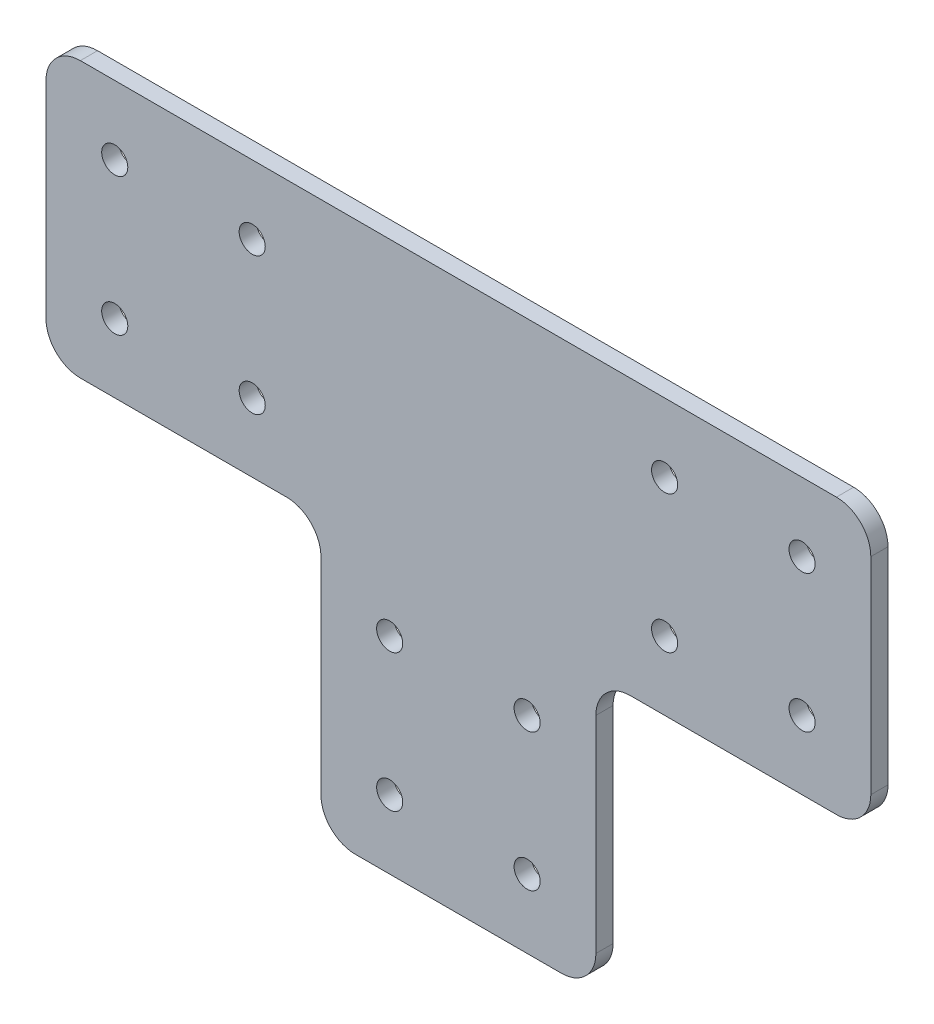
from build123d import *

# Parameters (mm, degrees)
SKETCH1_R           = 2.413
BOSS_EXTRUDE1_DEPTH = 3.175
FILLET1_R           = 6.35


with BuildPart() as part:
    # Sketch1 → Boss-Extrude1 (new body)
    with BuildSketch(Plane.XY):
        Polygon((-76.2, 0), (76.2, 0), (76.2, -50.8), (25.4, -50.8), (25.4, -101.6), (-25.4, -101.6), (-25.4, -50.8), (-76.2, -50.8), align=None)
        with Locations((-63.5, -12.7)):
            Circle(SKETCH1_R, mode=Mode.SUBTRACT)
        with Locations((-63.5, -38.1)):
            Circle(SKETCH1_R, mode=Mode.SUBTRACT)
        with Locations((-38.1, -12.7)):
            Circle(SKETCH1_R, mode=Mode.SUBTRACT)
        with Locations((-38.1, -38.1)):
            Circle(SKETCH1_R, mode=Mode.SUBTRACT)
        with Locations((-12.7, -88.9)):
            Circle(SKETCH1_R, mode=Mode.SUBTRACT)
        with Locations((-12.7, -63.5)):
            Circle(SKETCH1_R, mode=Mode.SUBTRACT)
        with Locations(Location((12.7, -88.9, 0), (0, 0, 180))):
            Circle(SKETCH1_R, mode=Mode.SUBTRACT)
        with Locations(Location((12.7, -63.5, 0), (0, 0, 180))):
            Circle(SKETCH1_R, mode=Mode.SUBTRACT)
        with Locations(Location((63.5, -38.1, 0), (0, 0, 180))):
            Circle(SKETCH1_R, mode=Mode.SUBTRACT)
        with Locations(Location((38.1, -38.1, 0), (0, 0, 180))):
            Circle(SKETCH1_R, mode=Mode.SUBTRACT)
        with Locations(Location((38.1, -12.7, 0), (0, 0, 180))):
            Circle(SKETCH1_R, mode=Mode.SUBTRACT)
        with Locations(Location((63.5, -12.7, 0), (0, 0, 180))):
            Circle(SKETCH1_R, mode=Mode.SUBTRACT)
    extrude(amount=BOSS_EXTRUDE1_DEPTH)

    # Fillet1
    fillet1_edges = [part.edges().sort_by_distance(p)[0] for p in [
        (25.4, -101.6, 1.5875),
        (-25.4, -101.6, 1.5875),
        (-25.4, -50.8, 1.5875),
        (-76.2, -50.8, 1.5875),
        (-76.2, 0, 1.5875),
        (76.2, 0, 1.5875),
        (76.2, -50.8, 1.5875),
        (25.4, -50.8, 1.5875),
    ]]
    fillet(fillet1_edges, radius=FILLET1_R)


solid = part.part
